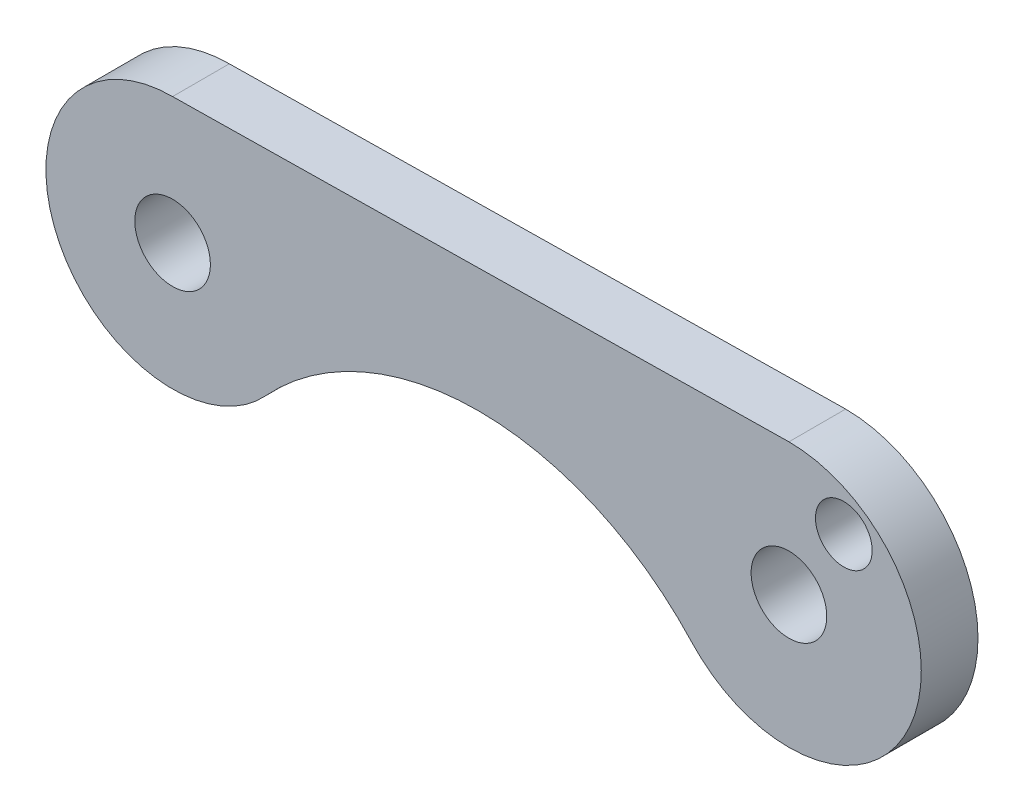
from build123d import *

# Parameters (mm, degrees)
SKETCH1_R           = 2
SKETCH1_R_2         = 1.5
BOSS_EXTRUDE1_DEPTH = 3


with BuildPart() as part:
    # Sketch1 → Boss-Extrude1 (new body)
    with BuildSketch(Plane.XY):
        with BuildLine():
            Line((-1.2291645, 7.272594351), (-33.6207003, 6.790167677))
            ThreePointArc((-33.6207003, 6.790167677), (-39.756779375, -2.600284623), (-28.692691922, -4.44907603))
            ThreePointArc((-28.692691922, -4.44907603), (-17.430920536, 0.485186112), (-6.174483245, -4.461232505))
            ThreePointArc((-6.174483245, -4.461232505), (5.388610173, -2.538681661), (-1.0207003, 7.275699134))
            Line((-1.0207003, 7.275699134), (-1.2291645, 7.272594351))
        make_face()
        with Locations((-33.6207003, 0.090167677)):
            Circle(SKETCH1_R, mode=Mode.SUBTRACT)
        with Locations((-1.0207003, 0.275699134)):
            Circle(SKETCH1_R, mode=Mode.SUBTRACT)
        with Locations((1.881986284, 4.492783471)):
            Circle(SKETCH1_R_2, mode=Mode.SUBTRACT)
    extrude(amount=BOSS_EXTRUDE1_DEPTH)


solid = part.part
